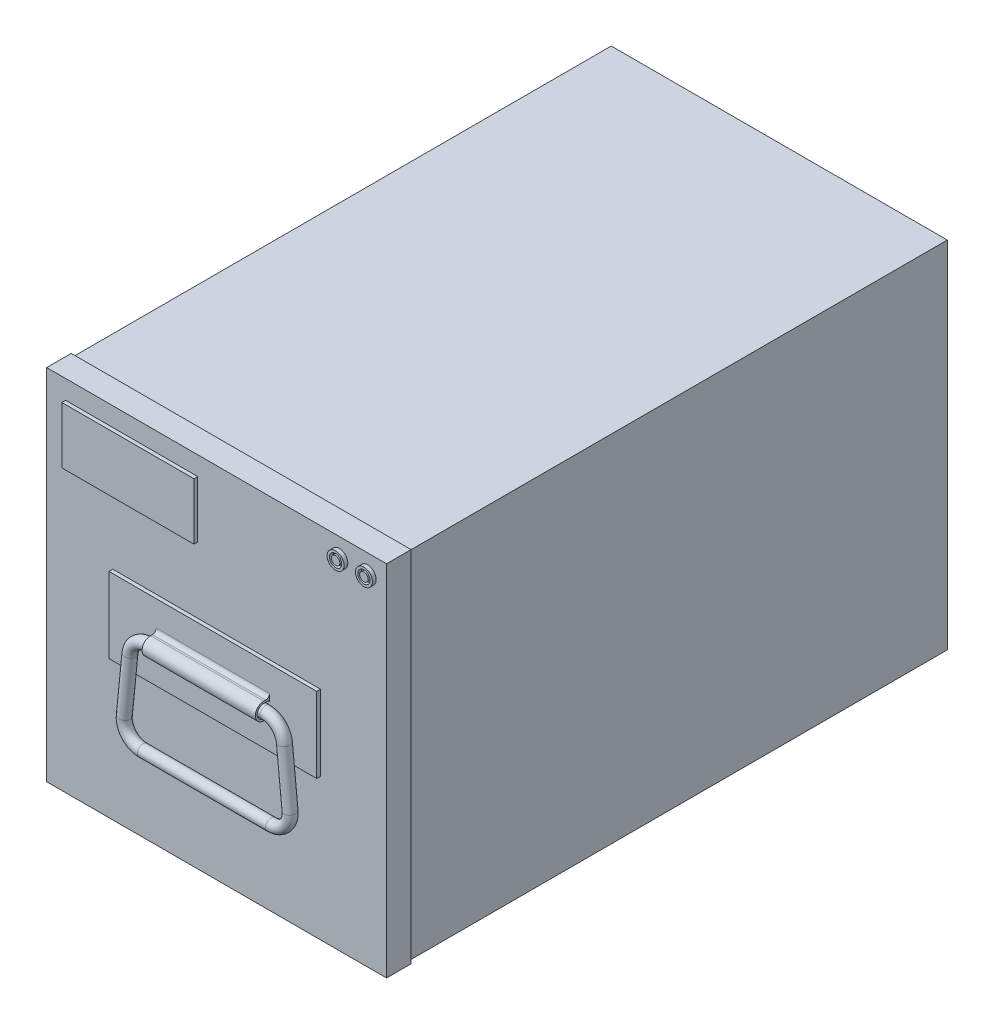
from build123d import *

# Parameters (mm, degrees)
SKETCH_1_W          = 180
SKETCH_1_H          = 190
EXTRUDE_2_DEPTH     = 13
SKETCH_1_4_W        = 178
SKETCH_1_4_H        = 188
EXTRUDE_3_DEPTH     = 285
SKETCH_2_W          = 70
SKETCH_2_H          = 30
SKETCH_2_W_2        = 110
SKETCH_2_H_2        = 40
EXTRUDE_4_DEPTH     = 2
SKETCH_4_R          = 3
SKETCH_13_R         = 4.5
EXTRUDE_5_DEPTH     = 2
SKETCH_13_3_R       = 3.25
SKETCH_13_3_R_2     = 2.25
CUT_EXTRUDE_1_DEPTH = 2
SKETCH_4_8_R        = 3
SKETCH_4_8_R_2      = 2
SKETCH_4_8_W        = 1
SKETCH_4_8_H        = 190
EXTRUDE_1_DEPTH     = 30
FILLET_1_R          = 2
FILLET_2_R          = 1


with BuildPart() as part:
    # 草图1 → 凸台-拉伸2 (new body)
    with BuildSketch(Plane.XY):
        Rectangle(SKETCH_1_W, SKETCH_1_H)
    extrude(amount=EXTRUDE_2_DEPTH)

    # 草图1<4> → 凸台-拉伸3 (add)
    with BuildSketch(Plane.XY):
        Rectangle(SKETCH_1_4_W, SKETCH_1_4_H)
    extrude(amount=-EXTRUDE_3_DEPTH)

    # 草图2 → 凸台-拉伸4 (add)
    with BuildSketch(Plane.XY.offset(13)):
        with Locations((-45, 70)):
            Rectangle(SKETCH_2_W, SKETCH_2_H)
        Rectangle(SKETCH_2_W_2, SKETCH_2_H_2)
    extrude(amount=EXTRUDE_4_DEPTH)

    # 草图13 → 凸台-拉伸5 (add)
    with BuildSketch(Plane.XY.offset(13)):
        with Locations(Location((65, 85, 0), (0, 0, 180))):
            Circle(SKETCH_13_R)
        with Locations(Location((80, 85, 0), (0, 0, 180))):
            Circle(SKETCH_13_R)
    extrude(amount=EXTRUDE_5_DEPTH)

    # 草图13<3> → 切除-拉伸-薄壁1 (cut)
    # profile 1 of 2: a face of its own
    with BuildSketch(Plane.XY.offset(13)):
        with Locations((80, 85)):
            Circle(SKETCH_13_3_R)
        with Locations((80, 85)):
            Circle(SKETCH_13_3_R_2, mode=Mode.SUBTRACT)
    # profile 2 of 2: a face of its own
    with BuildSketch(Plane.XY.offset(13)):
        with Locations((65, 85)):
            Circle(SKETCH_13_3_R)
        with Locations((65, 85)):
            Circle(SKETCH_13_3_R_2, mode=Mode.SUBTRACT)
    extrude(amount=CUT_EXTRUDE_1_DEPTH, mode=Mode.SUBTRACT)

    # 草图4<8> → 拉伸-薄壁1 (add, symmetric)
    # profile 1 of 4: a face of its own
    with BuildSketch(Plane(origin=(0, 0, 0), x_dir=(0, 0, -1), z_dir=(1, 0, 0))):
        with Locations((-18, 0)):
            Circle(SKETCH_4_8_R)
        with Locations((-18, 0)):
            Circle(SKETCH_4_8_R_2, mode=Mode.SUBTRACT)
    # profile 2 of 4: a face of its own
    with BuildSketch(Plane(origin=(0, 0, 0), x_dir=(0, 0, -1), z_dir=(1, 0, 0))):
        Polygon((-13, 20), (-15, 20), (-15, -20), (-13, -20), (-13, -19), (-14, -19), (-14, 19), (-13, 19), align=None)
    # profile 3 of 4: a face of its own
    with BuildSketch(Plane(origin=(0, 0, 0), x_dir=(0, 0, -1), z_dir=(1, 0, 0))):
        with Locations((-12.5, 0)):
            Rectangle(SKETCH_4_8_W, SKETCH_4_8_H)
    # profile 4 of 4: a face of its own
    with BuildSketch(Plane(origin=(0, 0, 0), x_dir=(0, 0, -1), z_dir=(1, 0, 0))):
        with BuildLine():
            Line((-15, -3.5), (-18, -3.5))
            ThreePointArc((-18, -3.5), (-21.5, 0), (-18, 3.5))
            Line((-18, 3.5), (-15, 3.5))
            Line((-15, 3.5), (-15, 4.5))
            Line((-15, 4.5), (-18, 4.5))
            ThreePointArc((-18, 4.5), (-22.5, 0), (-18, -4.5))
            Line((-18, -4.5), (-15, -4.5))
            Line((-15, -4.5), (-15, -3.5))
        make_face()
    extrude(amount=EXTRUDE_1_DEPTH, both=True)


with BuildPart() as body_2:
    # 扫描2: sweep along a path in 草图3
    with BuildLine(Plane.XY.offset(15)) as sweep_2_path:
        Line((-30.950124379, 0), (30.950124379, 0))
        ThreePointArc((30.950124379, 0), (37.660177586, -2.585474664), (40.900496281, -9.00496281))
        Line((40.900496281, -9.00496281), (43.900496281, -39.00496281))
        ThreePointArc((43.900496281, -39.00496281), (41.364649714, -46.710053208), (33.950124379, -50))
        Line((33.950124379, -50), (-33.950124379, -50))
        ThreePointArc((-33.950124379, -50), (-41.364649714, -46.710053208), (-43.900496281, -39.00496281))
        Line((-43.900496281, -39.00496281), (-40.900496281, -9.00496281))
        ThreePointArc((-40.900496281, -9.00496281), (-37.660177586, -2.585474664), (-30.950124379, 0))
    # 草图4 → 扫描2 (sweep)
    with BuildSketch(Plane(origin=(0, 0, 0), x_dir=(0, 0, -1), z_dir=(1, 0, 0))):
        with Locations((-18, 0)):
            Circle(SKETCH_4_R)
    sweep(path=sweep_2_path.line)


with BuildPart() as extrude_1_kept_piece:
    # of the separate pieces the step leaves, the one the design keeps (extrude_1_pieces_kept)
    add(part.part.solids().sort_by_distance((90, 95, 0))[0])

    # 圆角1
    fillet_1_edges = [extrude_1_kept_piece.edges().sort_by_distance(p)[0] for p in [
        (0, 4.5, 15),
        (0, -4.5, 15),
    ]]
    fillet(fillet_1_edges, radius=FILLET_1_R)

    # 圆角2
    fillet_2_edges = [extrude_1_kept_piece.edges().sort_by_distance(p)[0] for p in [
        (0, 3.5, 15),
        (0, -3.5, 15),
    ]]
    fillet(fillet_2_edges, radius=FILLET_2_R)


solid = Compound([body_2.part, extrude_1_kept_piece.part])
